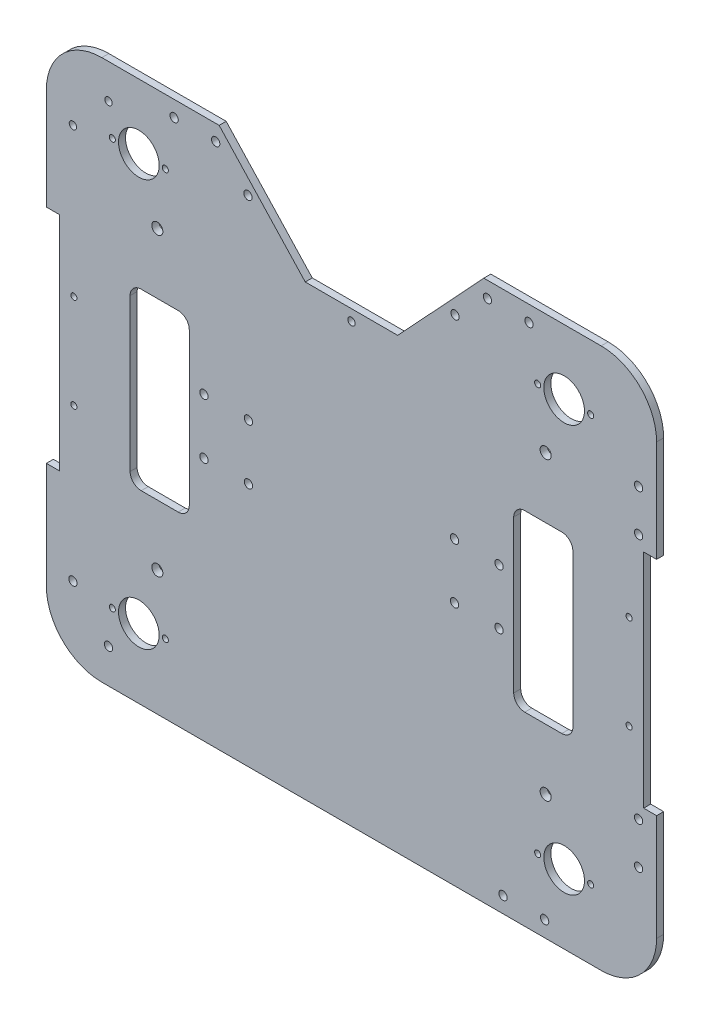
from build123d import *

# Parameters (mm, degrees)
SKETCH2_R           = 1.65
SKETCH2_R_2         = 11
SKETCH2_R_3         = 3
SKETCH2_R_4         = 2.25
SKETCH2_R_5         = 2
BOSS_EXTRUDE1_DEPTH = 3.8


with BuildPart() as part:
    # Sketch2 → Boss-Extrude1 (new body)
    with BuildSketch(Plane.XY):
        with BuildLine():
            Line((165, 115), (165, 60))
            Line((165, 60), (158, 60))
            Line((158, 60), (158, -60))
            Line((158, -60), (165, -60))
            Line((165, -60), (165, -117.5))
            ThreePointArc((165, -117.5), (156.213203436, -138.713203436), (135, -147.5))
            Line((135, -147.5), (-135, -147.5))
            ThreePointArc((-135, -147.5), (-156.213203436, -138.713203436), (-165, -117.5))
            Line((-165, -117.5), (-165, -60))
            Line((-165, -60), (-158, -60))
            Line((-158, -60), (-158, 60))
            Line((-158, 60), (-165, 60))
            Line((-165, 60), (-165, 115))
            ThreePointArc((-165, 115), (-156.213203436, 136.213203436), (-135, 145))
            Line((-135, 145), (-71.563974327, 145))
            Line((-71.563974327, 145), (-25.002785582, 94.922799803))
            Line((-25.002785582, 94.922799803), (25.002785582, 94.922799803))
            Line((25.002785582, 94.922799803), (71.563974327, 145))
            Line((71.563974327, 145), (135, 145))
            ThreePointArc((135, 145), (156.213203436, 136.213203436), (165, 115))
        make_face()
        with Locations(Location((-129.334802826, 110, 0), (0, 0, 180))):
            Circle(SKETCH2_R, mode=Mode.SUBTRACT)
        with Locations(Location((-100.665197174, 110, 0), (0, 0, 180))):
            Circle(SKETCH2_R, mode=Mode.SUBTRACT)
        with Locations(Location((129.334802826, 110, 0), (0, 0, 180))):
            Circle(SKETCH2_R, mode=Mode.SUBTRACT)
        with Locations(Location((100.665197174, 110, 0), (0, 0, 180))):
            Circle(SKETCH2_R, mode=Mode.SUBTRACT)
        with Locations(Location((129.334802826, -110, 0), (0, 0, 180))):
            Circle(SKETCH2_R, mode=Mode.SUBTRACT)
        with Locations(Location((100.665197174, -110, 0), (0, 0, 180))):
            Circle(SKETCH2_R, mode=Mode.SUBTRACT)
        with Locations(Location((-129.334802826, -110, 0), (0, 0, 180))):
            Circle(SKETCH2_R, mode=Mode.SUBTRACT)
        with Locations(Location((-100.665197174, -110, 0), (0, 0, 180))):
            Circle(SKETCH2_R, mode=Mode.SUBTRACT)
        with Locations(Location((115, 110, 0), (0, 0, 180))):
            Circle(SKETCH2_R_2, mode=Mode.SUBTRACT)
        with Locations(Location((-115, 110, 0), (0, 0, 180))):
            Circle(SKETCH2_R_2, mode=Mode.SUBTRACT)
        with Locations(Location((115, -110, 0), (0, 0, 180))):
            Circle(SKETCH2_R_2, mode=Mode.SUBTRACT)
        with Locations(Location((-115, -110, 0), (0, 0, 180))):
            Circle(SKETCH2_R_2, mode=Mode.SUBTRACT)
        with Locations(Location((-105, 80, 0), (0, 0, 180))):
            Circle(SKETCH2_R_3, mode=Mode.SUBTRACT)
        with Locations(Location((105, 80, 0), (0, 0, 180))):
            Circle(SKETCH2_R_3, mode=Mode.SUBTRACT)
        with Locations(Location((105, -80, 0), (0, 0, 180))):
            Circle(SKETCH2_R_3, mode=Mode.SUBTRACT)
        with Locations(Location((-105, -80, 0), (0, 0, 180))):
            Circle(SKETCH2_R_3, mode=Mode.SUBTRACT)
        with Locations(Location((150.121259344, -25.5, 0), (0, 0, 180))):
            Circle(SKETCH2_R, mode=Mode.SUBTRACT)
        with Locations(Location((150.121259344, 25.5, 0), (0, 0, 180))):
            Circle(SKETCH2_R, mode=Mode.SUBTRACT)
        with Locations(Location((-150.121259344, -25.5, 0), (0, 0, 180))):
            Circle(SKETCH2_R, mode=Mode.SUBTRACT)
        with Locations(Location((-150.121259344, 25.5, 0), (0, 0, 180))):
            Circle(SKETCH2_R, mode=Mode.SUBTRACT)
        with Locations(Location((-55.73, -14.995, 0), (0, 0, 180))):
            Circle(SKETCH2_R_4, mode=Mode.SUBTRACT)
        with Locations(Location((-55.73, 14.895, 0), (0, 0, 180))):
            Circle(SKETCH2_R_4, mode=Mode.SUBTRACT)
        with Locations(Location((-79.79, 14.895, 0), (0, 0, 180))):
            Circle(SKETCH2_R_4, mode=Mode.SUBTRACT)
        with Locations(Location((-79.79, -14.995, 0), (0, 0, 180))):
            Circle(SKETCH2_R_4, mode=Mode.SUBTRACT)
        with Locations(Location((79.79, -14.995, 0), (0, 0, 180))):
            Circle(SKETCH2_R_4, mode=Mode.SUBTRACT)
        with Locations(Location((55.73, -14.995, 0), (0, 0, 180))):
            Circle(SKETCH2_R_4, mode=Mode.SUBTRACT)
        with Locations(Location((55.73, 14.895, 0), (0, 0, 180))):
            Circle(SKETCH2_R_4, mode=Mode.SUBTRACT)
        with Locations(Location((79.79, 14.895, 0), (0, 0, 180))):
            Circle(SKETCH2_R_4, mode=Mode.SUBTRACT)
        with Locations(Location((56, 120, 0), (0, 0, 180))):
            Circle(SKETCH2_R_4, mode=Mode.SUBTRACT)
        with Locations(Location((0, 88.922799803, 0), (0, 0, 180))):
            Circle(SKETCH2_R_5, mode=Mode.SUBTRACT)
        with Locations(Location((-56, 120, 0), (0, 0, 180))):
            Circle(SKETCH2_R_4, mode=Mode.SUBTRACT)
        with Locations(Location((155.24999999, 66.777335257, 0), (0, 0, 180))):
            Circle(SKETCH2_R_4, mode=Mode.SUBTRACT)
        with Locations(Location((155.24999999, 89.256565873, 0), (0, 0, 180))):
            Circle(SKETCH2_R_4, mode=Mode.SUBTRACT)
        with Locations(Location((155.24999999, -66.572399887, 0), (0, 0, 180))):
            Circle(SKETCH2_R_4, mode=Mode.SUBTRACT)
        with Locations(Location((155.24999999, -89.051630503, 0), (0, 0, 180))):
            Circle(SKETCH2_R_4, mode=Mode.SUBTRACT)
        with Locations(Location((104.427600113, -138.94999999, 0), (0, 0, 180))):
            Circle(SKETCH2_R_4, mode=Mode.SUBTRACT)
        with Locations(Location((81.948369497, -138.94999999, 0), (0, 0, 180))):
            Circle(SKETCH2_R_4, mode=Mode.SUBTRACT)
        with Locations(Location((-131.400317146, -128.880285492, 0), (0, 0, 180))):
            Circle(SKETCH2_R_4, mode=Mode.SUBTRACT)
        with Locations(Location((-150.638323589, -107.961051525, 0), (0, 0, 180))):
            Circle(SKETCH2_R_4, mode=Mode.SUBTRACT)
        with Locations(Location((-150.638323589, 105.461051525, 0), (0, 0, 180))):
            Circle(SKETCH2_R_5, mode=Mode.SUBTRACT)
        with Locations(Location((-131.400317146, 126.380285492, 0), (0, 0, 180))):
            Circle(SKETCH2_R_5, mode=Mode.SUBTRACT)
        with Locations(Location((-73.437500654, 136.44999999, 0), (0, 0, 180))):
            Circle(SKETCH2_R_4, mode=Mode.SUBTRACT)
        with Locations(Location((-95.91673127, 136.44999999, 0), (0, 0, 180))):
            Circle(SKETCH2_R_4, mode=Mode.SUBTRACT)
        with Locations(Location((95.99157444, 136.44999999, 0), (0, 0, 180))):
            Circle(SKETCH2_R_4, mode=Mode.SUBTRACT)
        with Locations(Location((73.512343824, 136.44999999, 0), (0, 0, 180))):
            Circle(SKETCH2_R_4, mode=Mode.SUBTRACT)
        with BuildLine():
            Line((113.717640114, -47.179866734), (93.717640114, -47.179866734))
            ThreePointArc((93.717640114, -47.179866734), (89.474999427, -45.422507421), (87.717640114, -41.179866734))
            Line((87.717640114, -41.179866734), (87.717640114, 41.179866734))
            ThreePointArc((87.717640114, 41.179866734), (89.474999427, 45.422507421), (93.717640114, 47.179866734))
            Line((93.717640114, 47.179866734), (113.717640114, 47.179866734))
            ThreePointArc((113.717640114, 47.179866734), (117.960280801, 45.422507421), (119.717640114, 41.179866734))
            Line((119.717640114, 41.179866734), (119.717640114, -41.179866734))
            ThreePointArc((119.717640114, -41.179866734), (117.960280801, -45.422507421), (113.717640114, -47.179866734))
        make_face(mode=Mode.SUBTRACT)
        with BuildLine():
            Line((-113.717640114, 47.179866734), (-93.717640114, 47.179866734))
            ThreePointArc((-93.717640114, 47.179866734), (-89.474999427, 45.422507421), (-87.717640114, 41.179866734))
            Line((-87.717640114, 41.179866734), (-87.717640114, -41.179866734))
            ThreePointArc((-87.717640114, -41.179866734), (-89.474999427, -45.422507421), (-93.717640114, -47.179866734))
            Line((-93.717640114, -47.179866734), (-113.717640114, -47.179866734))
            ThreePointArc((-113.717640114, -47.179866734), (-117.960280801, -45.422507421), (-119.717640114, -41.179866734))
            Line((-119.717640114, -41.179866734), (-119.717640114, 41.179866734))
            ThreePointArc((-119.717640114, 41.179866734), (-117.960280801, 45.422507421), (-113.717640114, 47.179866734))
        make_face(mode=Mode.SUBTRACT)
    extrude(amount=BOSS_EXTRUDE1_DEPTH)


solid = part.part
